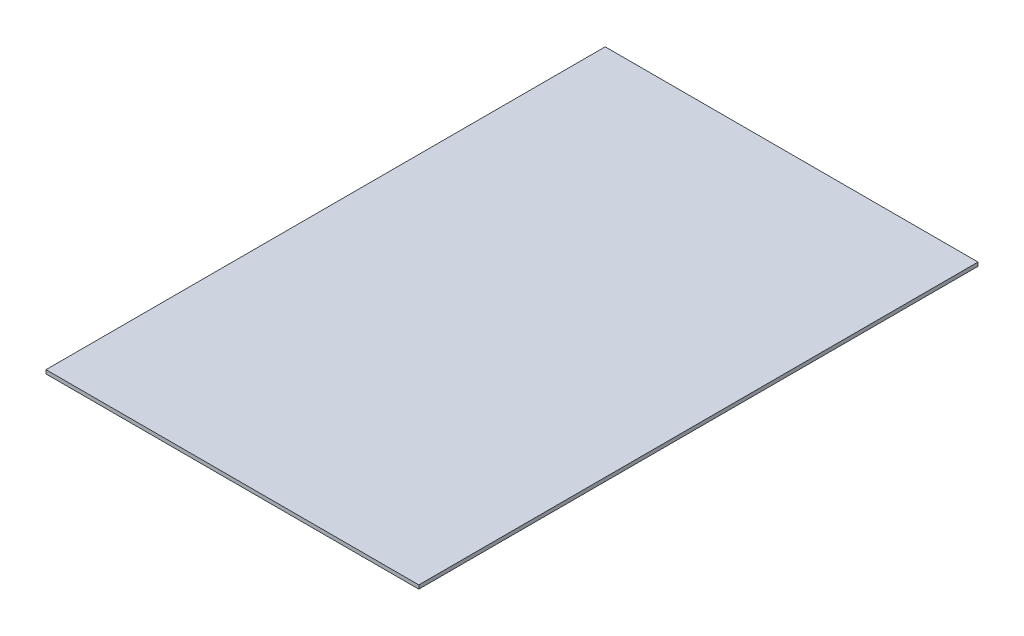
from build123d import *

# Parameters (mm, degrees)
SKETCH1_W           = 254
SKETCH1_H           = 381
BOSS_EXTRUDE1_DEPTH = 2.54


with BuildPart() as part:
    # Sketch1 → Boss-Extrude1 (new body)
    with BuildSketch(Plane(origin=(0, 0, 0), x_dir=(1, 0, 0), z_dir=(0, 1, 0))):
        Rectangle(SKETCH1_W, SKETCH1_H)
    extrude(amount=BOSS_EXTRUDE1_DEPTH)


solid = part.part
